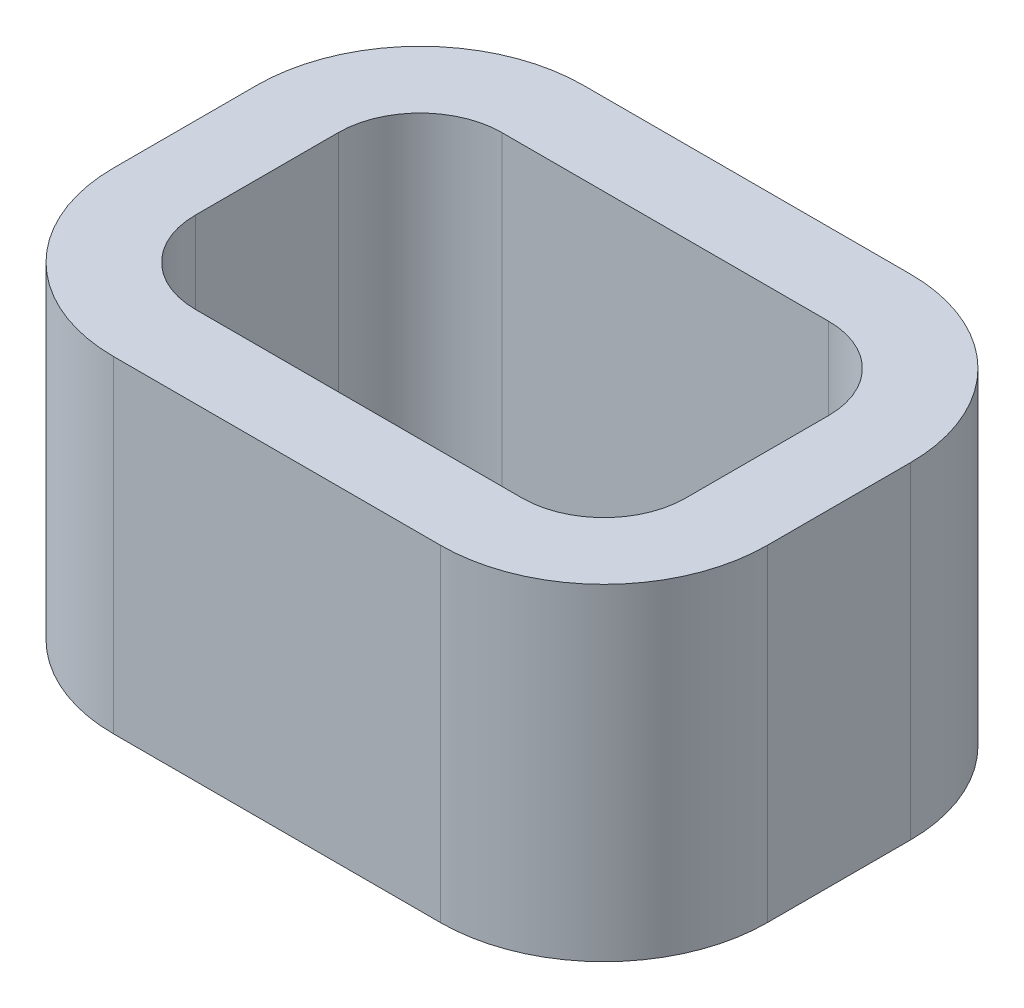
from build123d import *

# Parameters (mm, degrees)
BOSS_EXTRUDE1_DEPTH = 0.8
CUT_EXTRUDE1_DEPTH  = 2.61322658


with BuildPart() as part:
    # Sketch1 → Boss-Extrude1 (new body)
    with BuildSketch(Plane(origin=(0, 0, 0), x_dir=(1, 0, 0), z_dir=(0, 1, 0))):
        with BuildLine():
            Line((0, 0), (0.4, 0))
            ThreePointArc((0.4, 0), (0.682842712, -0.117157288), (0.8, -0.4))
            Line((0.8, -0.4), (0.8, -0.75))
            ThreePointArc((0.8, -0.75), (0.682842712, -1.032842712), (0.4, -1.15))
            Line((0.4, -1.15), (-0.4, -1.15))
            ThreePointArc((-0.4, -1.15), (-0.682842712, -1.032842712), (-0.8, -0.75))
            Line((-0.8, -0.75), (-0.8, -0.4))
            ThreePointArc((-0.8, -0.4), (-0.682842712, -0.117157288), (-0.4, 0))
            Line((-0.4, 0), (0, 0))
        make_face()
    extrude(amount=BOSS_EXTRUDE1_DEPTH)

    # Sketch2 → Cut-Extrude1 (cut, through all)
    with BuildSketch(Plane(origin=(0, 0.8, 0), x_dir=(1, 0, 0), z_dir=(0, 1, 0))):
        with BuildLine():
            Line((-0.4, -0.2), (0.4, -0.2))
            ThreePointArc((0.4, -0.2), (0.541421356, -0.258578644), (0.6, -0.4))
            Line((0.6, -0.4), (0.6, -0.75))
            ThreePointArc((0.6, -0.75), (0.541421356, -0.891421356), (0.4, -0.95))
            Line((0.4, -0.95), (-0.4, -0.95))
            ThreePointArc((-0.4, -0.95), (-0.541421356, -0.891421356), (-0.6, -0.75))
            Line((-0.6, -0.75), (-0.6, -0.4))
            ThreePointArc((-0.6, -0.4), (-0.541421356, -0.258578644), (-0.4, -0.2))
        make_face()
    extrude(amount=-CUT_EXTRUDE1_DEPTH, mode=Mode.SUBTRACT)


solid = part.part
